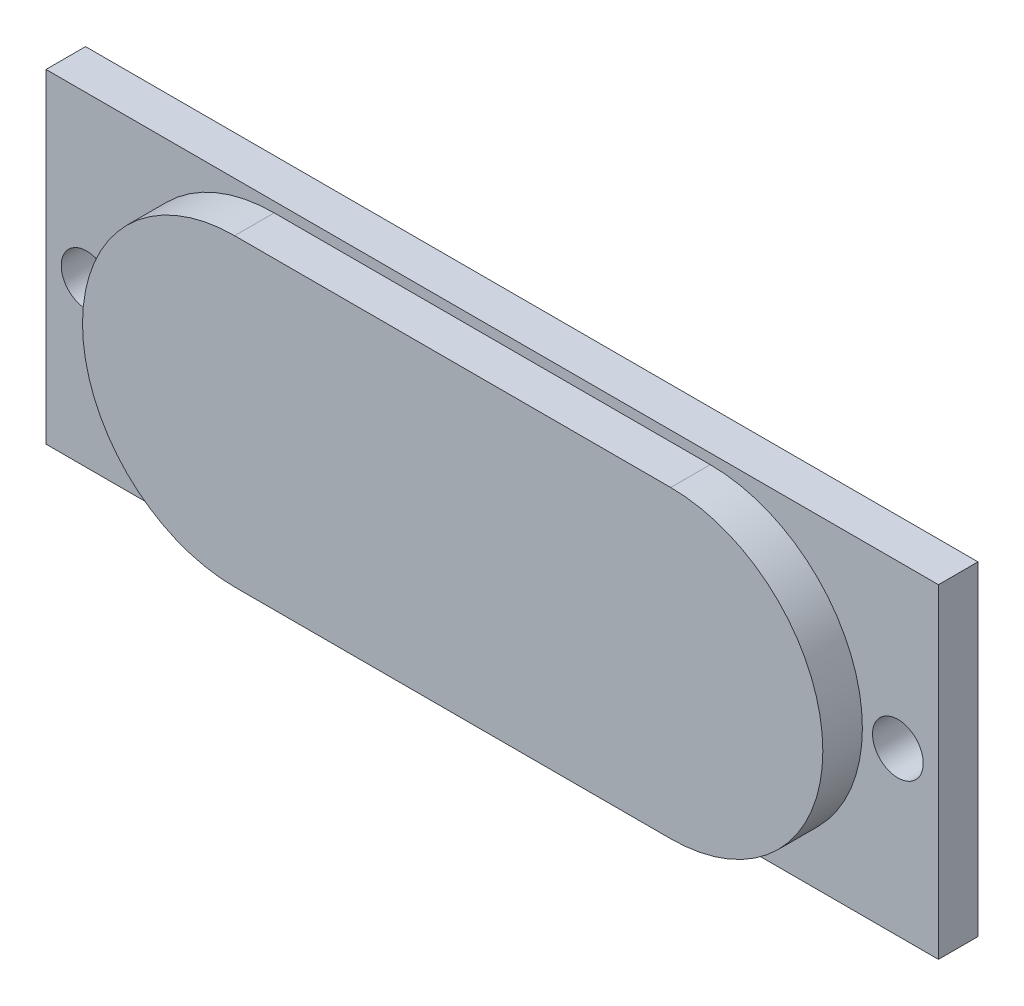
from build123d import *

# Parameters (mm, degrees)
SKETCH2_W            = 111.76
SKETCH2_H            = 40.64
SKETCH2_R            = 3.175
BOSS_EXTRUDE13_DEPTH = 4.953
BOSS_EXTRUDE14_DEPTH = 4.953


with BuildPart() as part:
    # Sketch2 → Boss-Extrude13 (new body)
    with BuildSketch(Plane.XY):
        Rectangle(SKETCH2_W, SKETCH2_H)
        with Locations((50.8, 0)):
            Circle(SKETCH2_R, mode=Mode.SUBTRACT)
        with Locations((-50.8, 0)):
            Circle(SKETCH2_R, mode=Mode.SUBTRACT)
    extrude(amount=BOSS_EXTRUDE13_DEPTH)

    # Sketch3 → Boss-Extrude14 (add)
    with BuildSketch(Plane.XY.offset(4.953)):
        with BuildLine():
            Line((27.305, -19.05), (-27.305, -19.05))
            ThreePointArc((-27.305, -19.05), (-46.355, 0), (-27.305, 19.05))
            Line((-27.305, 19.05), (27.305, 19.05))
            ThreePointArc((27.305, 19.05), (46.355, 0), (27.305, -19.05))
        make_face()
    extrude(amount=BOSS_EXTRUDE14_DEPTH)


solid = part.part
